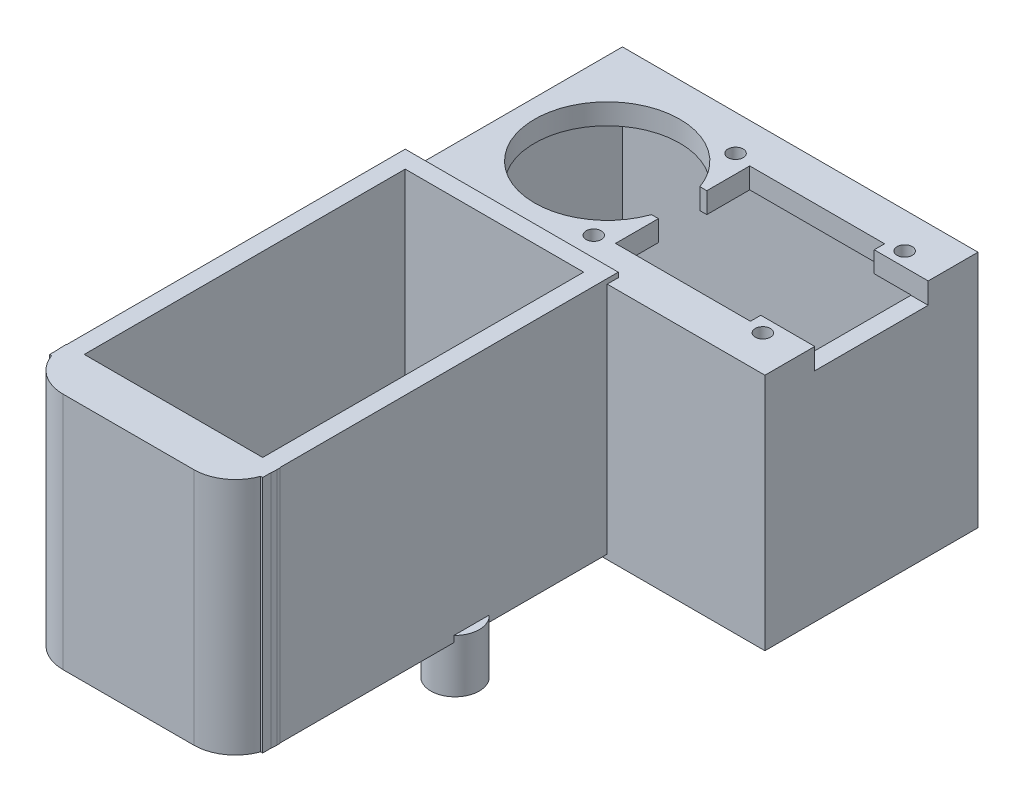
from build123d import *

# Parameters (mm, degrees)
S_BOX1_W        = 30.8
S_BOX1_H        = 34.5
BOSS_1_DEPTH    = 2.5
S_BOX2_W        = 30.8
S_BOX2_H        = 34.5
BOSS_2_DEPTH    = 2.5
S_BOX3_W        = 2.5
S_BOX3_H        = 34.5
BOSS_3_DEPTH    = 51.4
S_BOX4_W        = 2.5
S_BOX4_H        = 34.5
BOSS_4_DEPTH    = 51.4
S_BOX5_W        = 30.8
S_BOX5_H        = 3
BOSS_5_DEPTH    = 51.4
S_BOX6_W        = 2.5
S_BOX6_H        = 34.5
BOSS_6_DEPTH    = 30.8
S_BOX7_W        = 2.5
S_BOX7_H        = 34.5
BOSS_7_DEPTH    = 30.8
S_BOX8_W        = 51.4
S_BOX8_H        = 34.5
BOSS_8_DEPTH    = 2.5
S_BOX9_W        = 51.4
S_BOX9_H        = 34.5
BOSS_9_DEPTH    = 2.5
S_BOX10_W       = 51.4
S_BOX10_H       = 3
BOSS_10_DEPTH   = 30.8
BOSS_11_DEPTH   = 34.5
S_CYL12_R       = 3.5
BOSS_12_DEPTH   = 7.7
S_HOLE13_R      = 10.5
HOLE_13_DEPTH   = 3.2
S_CUT14_W       = 19.4
S_CUT14_H       = 3.15
POCKET_14_DEPTH = 19.5
S_CUT15_W       = 16.4
S_CUT15_H       = 3.15
POCKET_15_DEPTH = 8.3
S_CUT16_W       = 7
S_CUT16_H       = 3.15
POCKET_16_DEPTH = 11
S_HOLE17_R      = 1.1
HOLE_17_DEPTH   = 3.2
S_HOLE18_R      = 1.1
HOLE_18_DEPTH   = 3.2
S_HOLE19_R      = 1.1
HOLE_19_DEPTH   = 3.2
S_HOLE20_R      = 1.1
HOLE_20_DEPTH   = 3.2
S_HOLE21_R      = 10.5
HOLE_21_DEPTH   = 3.2
S_CUT22_W       = 19.5
S_CUT22_H       = 3.15
POCKET_22_DEPTH = 19.4
S_CUT23_W       = 8.3
S_CUT23_H       = 3.15
POCKET_23_DEPTH = 16.4
S_CUT24_W       = 11
S_CUT24_H       = 3.15
POCKET_24_DEPTH = 7
S_HOLE25_R      = 1.1
HOLE_25_DEPTH   = 3.2
S_HOLE26_R      = 1.1
HOLE_26_DEPTH   = 3.2
S_HOLE27_R      = 1.1
HOLE_27_DEPTH   = 3.2
S_HOLE28_R      = 1.1
HOLE_28_DEPTH   = 3.2


with BuildPart() as part:
    # S_box1 → Boss_1 (new body)
    with BuildSketch(Plane.XY.offset(-38.2)):
        with Locations((0, -20.15)):
            Rectangle(S_BOX1_W, S_BOX1_H)
    extrude(amount=BOSS_1_DEPTH)



with BuildPart() as body_2:
    # S_box2 → Boss_2 (new body)
    with BuildSketch(Plane.XY.offset(10.7)):
        with Locations((0, -20.15)):
            Rectangle(S_BOX2_W, S_BOX2_H)
    extrude(amount=BOSS_2_DEPTH)


with BuildPart() as part_1:
    add(part.part)

    add(body_2.part)  # Boss_3 merges body 2
    # S_box3 → Boss_3 (add)
    with BuildSketch(Plane.XY.offset(-38.2)):
        with Locations((-14.15, -20.15)):
            Rectangle(S_BOX3_W, S_BOX3_H)
    extrude(amount=BOSS_3_DEPTH)

    # S_box4 → Boss_4 (add)
    with BuildSketch(Plane.XY.offset(-38.2)):
        with Locations((14.15, -20.15)):
            Rectangle(S_BOX4_W, S_BOX4_H)
    extrude(amount=BOSS_4_DEPTH)

    # S_box5 → Boss_5 (add)
    with BuildSketch(Plane.XY.offset(-38.2)):
        with Locations((0, -35.9)):
            Rectangle(S_BOX5_W, S_BOX5_H)
    extrude(amount=BOSS_5_DEPTH)

    # S_box6 → Boss_6 (add)
    with BuildSketch(Plane.XY.offset(-67.4)):
        with Locations((-11.95, -20.85)):
            Rectangle(S_BOX6_W, S_BOX6_H)
    extrude(amount=BOSS_6_DEPTH)



with BuildPart() as body_2_2:
    # S_box7 → Boss_7 (new body)
    with BuildSketch(Plane.XY.offset(-67.4)):
        with Locations((36.95, -20.85)):
            Rectangle(S_BOX7_W, S_BOX7_H)
    extrude(amount=BOSS_7_DEPTH)


with BuildPart() as part_2:
    add(part_1.part)

    add(body_2_2.part)  # Boss_8 merges body 2 2
    # S_box8 → Boss_8 (add)
    with BuildSketch(Plane.XY.offset(-67.4)):
        with Locations((12.5, -20.85)):
            Rectangle(S_BOX8_W, S_BOX8_H)
    extrude(amount=BOSS_8_DEPTH)

    # S_box9 → Boss_9 (add)
    with BuildSketch(Plane.XY.offset(-39.1)):
        with Locations((12.5, -20.85)):
            Rectangle(S_BOX9_W, S_BOX9_H)
    extrude(amount=BOSS_9_DEPTH)

    # S_box10 → Boss_10 (add)
    with BuildSketch(Plane.XY.offset(-67.4)):
        with Locations((12.5, -5.1)):
            Rectangle(S_BOX10_W, S_BOX10_H)
    extrude(amount=BOSS_10_DEPTH)

    # S_prism11 → Boss_11 (add)
    with BuildSketch(Plane(origin=(0, -37.4, 0), x_dir=(1, 0, 0), z_dir=(0, 1, 0))):
        with BuildLine():
            Line((-15.45, -10.75), (15.45, -10.75))
            Line((15.45, -10.75), (15.45, -11.2))
            ThreePointArc((15.45, -11.2), (13.6926, -15.4426), (9.45, -17.2))
            Line((9.45, -17.2), (-9.45, -17.2))
            ThreePointArc((-9.45, -17.2), (-13.6926, -15.4426), (-15.45, -11.2))
            Line((-15.45, -11.2), (-15.45, -10.75))
        make_face()
    extrude(amount=BOSS_11_DEPTH)

    # S_cyl12 → Boss_12 (add)
    with BuildSketch(Plane(origin=(0, -44.2, 0), x_dir=(1, 0, 0), z_dir=(0, 1, 0))):
        with Locations(Location((13, 17, 0), (0, 0, 46.708192407))):
            Circle(S_CYL12_R)
    extrude(amount=BOSS_12_DEPTH)

    # S_hole13 → Hole_13 (cut)
    with BuildSketch(Plane(origin=(0, -37.5, 0), x_dir=(1, 0, 0), z_dir=(0, 1, 0))):
        with Locations(Location((0, 0, 0), (0, 0, 90))):
            Circle(S_HOLE13_R)
    extrude(amount=HOLE_13_DEPTH, mode=Mode.SUBTRACT)

    # S_cut14 → Pocket_14 (cut)
    with BuildSketch(Plane.XY.offset(-30.4)):
        with Locations((0, -35.925)):
            Rectangle(S_CUT14_W, S_CUT14_H)
    extrude(amount=POCKET_14_DEPTH, mode=Mode.SUBTRACT)

    # S_cut15 → Pocket_15 (cut)
    with BuildSketch(Plane.XY.offset(-38.7)):
        with Locations((0, -35.925)):
            Rectangle(S_CUT15_W, S_CUT15_H)
    extrude(amount=POCKET_15_DEPTH, mode=Mode.SUBTRACT)

    # S_cut16 → Pocket_16 (cut)
    with BuildSketch(Plane.XY.offset(-11)):
        with Locations((0, -35.925)):
            Rectangle(S_CUT16_W, S_CUT16_H)
    extrude(amount=POCKET_16_DEPTH, mode=Mode.SUBTRACT)

    # S_hole17 → Hole_17 (cut)
    with BuildSketch(Plane(origin=(0, -37.5, 0), x_dir=(1, 0, 0), z_dir=(0, 1, 0))):
        with Locations(Location((-10.25, 8.3, 0), (0, 0, 90))):
            Circle(S_HOLE17_R)
    extrude(amount=HOLE_17_DEPTH, mode=Mode.SUBTRACT)

    # S_hole18 → Hole_18 (cut)
    with BuildSketch(Plane(origin=(0, -37.5, 0), x_dir=(1, 0, 0), z_dir=(0, 1, 0))):
        with Locations(Location((10.25, 8.3, 0), (0, 0, 90))):
            Circle(S_HOLE18_R)
    extrude(amount=HOLE_18_DEPTH, mode=Mode.SUBTRACT)

    # S_hole19 → Hole_19 (cut)
    with BuildSketch(Plane(origin=(0, -37.5, 0), x_dir=(1, 0, 0), z_dir=(0, 1, 0))):
        with Locations(Location((-10.25, 32.75, 0), (0, 0, 90))):
            Circle(S_HOLE19_R)
    extrude(amount=HOLE_19_DEPTH, mode=Mode.SUBTRACT)

    # S_hole20 → Hole_20 (cut)
    with BuildSketch(Plane(origin=(0, -37.5, 0), x_dir=(1, 0, 0), z_dir=(0, 1, 0))):
        with Locations(Location((10.25, 32.75, 0), (0, 0, 90))):
            Circle(S_HOLE20_R)
    extrude(amount=HOLE_20_DEPTH, mode=Mode.SUBTRACT)

    # S_hole21 → Hole_21 (cut)
    with BuildSketch(Plane(origin=(0, -6.7, 0), x_dir=(1, 0, 0), z_dir=(0, 1, 0))):
        with Locations(Location((0, 52, 0), (0, 0, 90))):
            Circle(S_HOLE21_R)
    extrude(amount=HOLE_21_DEPTH, mode=Mode.SUBTRACT)

    # S_cut22 → Pocket_22 (cut)
    with BuildSketch(Plane.XY.offset(-61.7)):
        with Locations((20.65, -5.075)):
            Rectangle(S_CUT22_W, S_CUT22_H)
    extrude(amount=POCKET_22_DEPTH, mode=Mode.SUBTRACT)

    # S_cut23 → Pocket_23 (cut)
    with BuildSketch(Plane.XY.offset(-60.2)):
        with Locations((34.55, -5.075)):
            Rectangle(S_CUT23_W, S_CUT23_H)
    extrude(amount=POCKET_23_DEPTH, mode=Mode.SUBTRACT)

    # S_cut24 → Pocket_24 (cut)
    with BuildSketch(Plane.XY.offset(-55.5)):
        with Locations((5.5, -5.075)):
            Rectangle(S_CUT24_W, S_CUT24_H)
    extrude(amount=POCKET_24_DEPTH, mode=Mode.SUBTRACT)

    # S_hole25 → Hole_25 (cut)
    with BuildSketch(Plane(origin=(0, -6.7, 0), x_dir=(1, 0, 0), z_dir=(0, 1, 0))):
        with Locations(Location((8.3, 62.25, 0), (0, 0, 90))):
            Circle(S_HOLE25_R)
    extrude(amount=HOLE_25_DEPTH, mode=Mode.SUBTRACT)

    # S_hole26 → Hole_26 (cut)
    with BuildSketch(Plane(origin=(0, -6.7, 0), x_dir=(1, 0, 0), z_dir=(0, 1, 0))):
        with Locations(Location((8.3, 41.75, 0), (0, 0, 90))):
            Circle(S_HOLE26_R)
    extrude(amount=HOLE_26_DEPTH, mode=Mode.SUBTRACT)

    # S_hole27 → Hole_27 (cut)
    with BuildSketch(Plane(origin=(0, -6.7, 0), x_dir=(1, 0, 0), z_dir=(0, 1, 0))):
        with Locations(Location((32.75, 62.25, 0), (0, 0, 90))):
            Circle(S_HOLE27_R)
    extrude(amount=HOLE_27_DEPTH, mode=Mode.SUBTRACT)

    # S_hole28 → Hole_28 (cut)
    with BuildSketch(Plane(origin=(0, -6.7, 0), x_dir=(1, 0, 0), z_dir=(0, 1, 0))):
        with Locations(Location((32.75, 41.75, 0), (0, 0, 90))):
            Circle(S_HOLE28_R)
    extrude(amount=HOLE_28_DEPTH, mode=Mode.SUBTRACT)


solid = part_2.part
